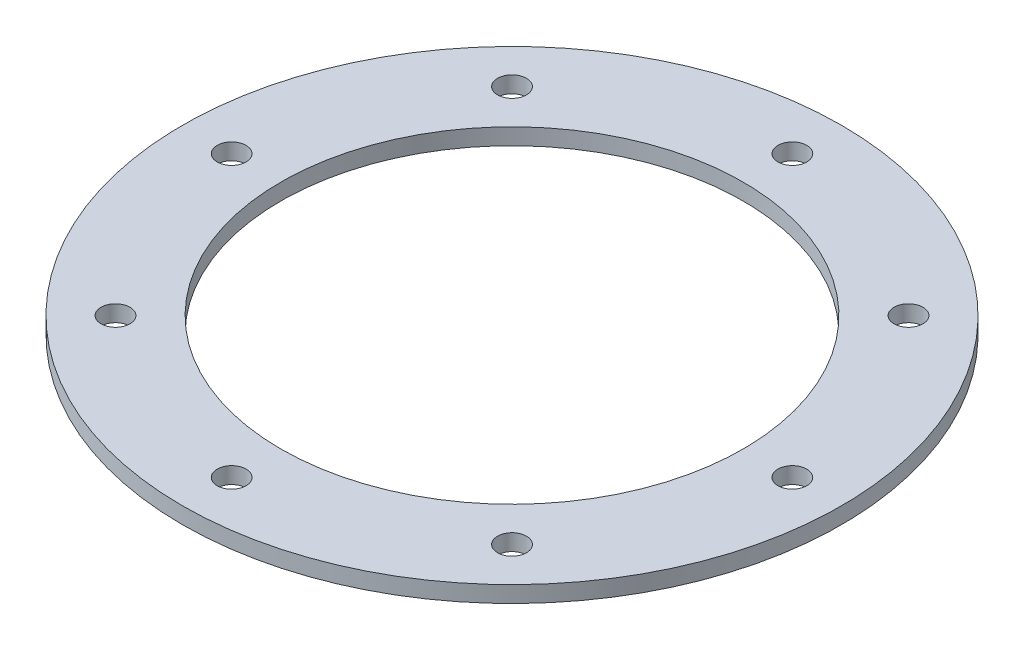
from build123d import *

# Parameters (mm, degrees)
SKETCH_1_R      = 100.5
SKETCH_1_R_2    = 70.5
SKETCH_1_R_3    = 4.4
EXTRUDE_1_DEPTH = 5


with BuildPart() as part:
    # Эскиз1 → Бобышка-Вытянуть1 (new body)
    with BuildSketch(Plane(origin=(0, 0, 0), x_dir=(1, 0, 0), z_dir=(0, 1, 0))):
        with Locations(Location((0, 0, 0), (0, 0, 270))):
            Circle(SKETCH_1_R)
        with Locations(Location((0, 0, 0), (0, 0, 270))):
            Circle(SKETCH_1_R_2, mode=Mode.SUBTRACT)
        with Locations(Location((85.5, 0, 0), (0, 0, 270))):
            Circle(SKETCH_1_R_3, mode=Mode.SUBTRACT)
        with Locations(Location((60.457629791, -60.457629791, 0), (0, 0, 270))):
            Circle(SKETCH_1_R_3, mode=Mode.SUBTRACT)
        with Locations(Location((0, -85.5, 0), (0, 0, 270))):
            Circle(SKETCH_1_R_3, mode=Mode.SUBTRACT)
        with Locations(Location((-60.457629791, -60.457629791, 0), (0, 0, 270))):
            Circle(SKETCH_1_R_3, mode=Mode.SUBTRACT)
        with Locations(Location((-85.5, 0, 0), (0, 0, 270))):
            Circle(SKETCH_1_R_3, mode=Mode.SUBTRACT)
        with Locations(Location((-60.457629791, 60.457629791, 0), (0, 0, 270))):
            Circle(SKETCH_1_R_3, mode=Mode.SUBTRACT)
        with Locations(Location((0, 85.5, 0), (0, 0, 270))):
            Circle(SKETCH_1_R_3, mode=Mode.SUBTRACT)
        with Locations(Location((60.457629791, 60.457629791, 0), (0, 0, 270))):
            Circle(SKETCH_1_R_3, mode=Mode.SUBTRACT)
    extrude(amount=EXTRUDE_1_DEPTH)


solid = part.part
